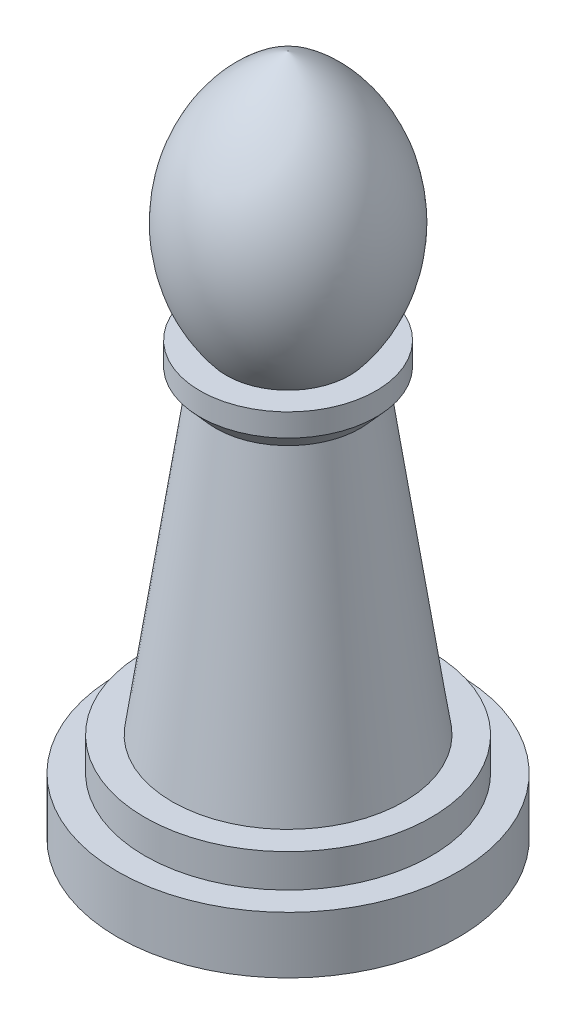
from build123d import *


with BuildPart() as part:
    # Sketch1 → Revolve1 (revolve)
    with BuildSketch(Plane.XY, mode=Mode.PRIVATE) as revolve1_sk:
        with BuildLine():
            Line((0, 0), (0, 38.1))
            ThreePointArc((0, 38.1), (-5.221326126, 31.976872569), (-3.437642592, 24.13))
            Line((-3.437642592, 24.13), (-4.919102977, 24.13))
            Line((-4.919102977, 24.13), (-4.919102977, 22.86))
            Line((-4.919102977, 22.86), (-4.0386, 21.873862293))
            Line((-4.0386, 21.873862293), (-6.477, 5.033662293))
            Line((-6.477, 5.033662293), (-8.001, 5.033662293))
            Line((-8.001, 5.033662293), (-8.001, 3.175))
            Line((-8.001, 3.175), (-9.525, 3.175))
            Line((-9.525, 3.175), (-9.525, 0))
            Line((-9.525, 0), (0, 0))
        make_face()
    revolve(revolve1_sk.sketch.rotate(Axis((0, 38.1, 0), (0, -1, 0)), 270), axis=Axis((0, 38.1, 0), (0, -1, 0)))


solid = part.part
